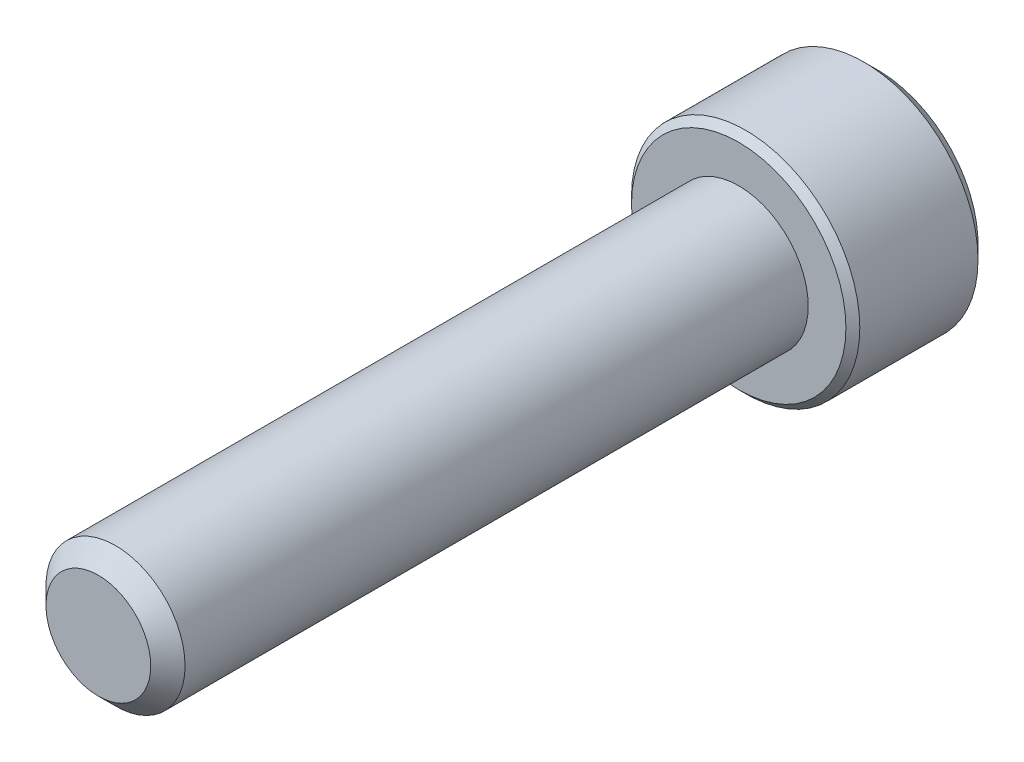
from build123d import *

# Parameters (mm, degrees)
SKETCH1_R          = 2.413
EXTRUDE1_DEPTH     = 22.225
CHAMFER3_SIZE      = 0.5953125
SKETCH6_R          = 3.9624
EXTRUDE2_DEPTH     = 4.826
CUT_EXTRUDE1_DEPTH = 2.9765625
SKETCH8_R          = 2.291358881
CUT_EXTRUDE2_DEPTH = 0.4826
CUT_EXTRUDE2_DRAFT = -45
CHAMFER1_SIZE      = 0.4826
CHAMFER2_SIZE      = 0.2413


with BuildPart() as part:
    # Sketch1 → Extrude1 (new body)
    with BuildSketch(Plane.XY):
        Circle(SKETCH1_R)
    extrude(amount=-EXTRUDE1_DEPTH)

    # Chamfer3
    chamfer3_edges = [part.edges().sort_by_distance(p)[0] for p in [
        (-2.413, 0, 0),
    ]]
    chamfer(chamfer3_edges, length=CHAMFER3_SIZE)

    # Sketch6 → Extrude2 (add)
    with BuildSketch(Plane(origin=(0, 0, -22.225), x_dir=(-1, 0, 0), z_dir=(0, 0, -1))):
        Circle(SKETCH6_R)
    extrude(amount=EXTRUDE2_DEPTH)

    # Sketch7 → Cut-Extrude1 (cut)
    with BuildSketch(Plane(origin=(0, 0, -27.051), x_dir=(-1, 0, 0), z_dir=(0, 0, -1))):
        Polygon((0, 2.291358881), (-1.984375, 1.14567944), (-1.984375, -1.14567944), (0, -2.291358881), (1.984375, -1.14567944), (1.984375, 1.14567944), align=None)
    extrude(amount=-CUT_EXTRUDE1_DEPTH, mode=Mode.SUBTRACT)


with BuildPart() as cut_extrude2_tool:
    # Sketch8 → Cut-Extrude2 (with draft: the straight prism first)
    with BuildSketch(Plane(origin=(0, 0, -27.051), x_dir=(-1, 0, 0), z_dir=(0, 0, -1))):
        Circle(SKETCH8_R)
    extrude(amount=-CUT_EXTRUDE2_DEPTH)
    # Cut-Extrude2: the draft: its side faces are tilted about the plane it starts from
    cut_extrude2_sides = [cut_extrude2_tool.faces().sort_by_distance(p)[0] for p in [
        (2.291358881, 0, -26.8097),
    ]]
    draft(cut_extrude2_sides, Plane(origin=(0, 0, -27.051), x_dir=(-1, 0, 0), z_dir=(0, 0, -1)), CUT_EXTRUDE2_DRAFT)


with BuildPart() as part_1:
    add(part.part)

    # Cut-Extrude2: cut by cut_extrude2_tool
    add(cut_extrude2_tool.part, mode=Mode.SUBTRACT)

    # Chamfer1
    chamfer1_edges = [part_1.edges().sort_by_distance(p)[0] for p in [
        (3.9624, 0, -27.051),
    ]]
    chamfer(chamfer1_edges, length=CHAMFER1_SIZE)

    # Chamfer2
    chamfer2_edges = [part_1.edges().sort_by_distance(p)[0] for p in [
        (3.9624, 0, -22.225),
    ]]
    chamfer(chamfer2_edges, length=CHAMFER2_SIZE)


solid = part_1.part
